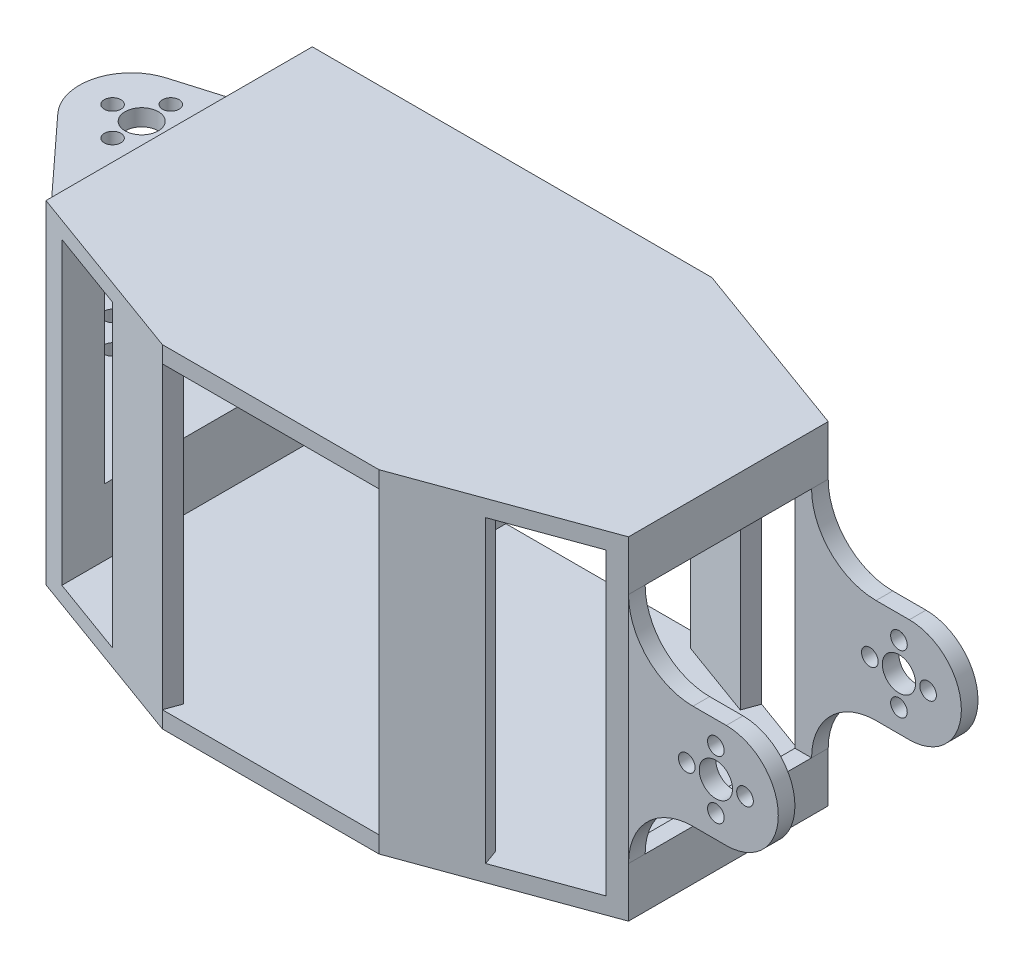
from build123d import *

# Parameters (mm, degrees)
SALIENTE_EXTRUIR1_DEPTH         = 25
CORTAR_EXTRUIR1_REACH           = 63.754
CROQUIS3_R                      = 4
CROQUIS3_R_2                    = 2
CROQUIS4_W                      = 32
CROQUIS4_H                      = 24.152956225
CORTAR_EXTRUIR2_DEPTH           = 40
SALIENTE_EXTRUIR3_DEPTH         = 72.5
SALIENTE_EXTRUIR3_DEPTH_BACK    = 7.5
CORTAR_EXTRUIR4_DEPTH           = 10
CORTAR_EXTRUIR4_DEPTH_BACK      = 10
CROQUIS8_W                      = 40
CROQUIS8_H                      = 62
REDONDEO1_RADIUS                = 12.5
REDONDEO1_LENGTH                = 4
REDONDEO2_RADIUS                = 12.5
REDONDEO2_LENGTH                = 4
CROQUIS9_W                      = 25
CROQUIS9_H                      = 4
SALIENTE_EXTRUIR4_DEPTH         = 36
CROQUIS10_R                     = 4
CROQUIS10_R_2                   = 2
CORTAR_EXTRUIR5_DEPTH           = 36
REDONDEO3_RADIUS                = 12.5
REDONDEO3_LENGTH                = 4
REDONDEO3_OF_SIMETR_A1_2_RADIUS = 12.5
REDONDEO3_OF_SIMETR_A1_2_LENGTH = 4
CROQUIS11_W                     = 56
CROQUIS11_H                     = 40
CORTAR_EXTRUIR6_DEPTH           = 36
CROQUIS16_W                     = 40
CROQUIS16_H                     = 16
SALIENTE_EXTRUIR6_DEPTH         = 6
CORTAR_EXTRUIR7_REACH           = 213.835
CROQUIS17_W                     = 20
CROQUIS17_H                     = 72
SALIENTE_EXTRUIR7_DEPTH         = 4
SALIENTE_EXTRUIR8_DEPTH         = 4
CROQUIS23_W                     = 7.762522615
CROQUIS23_H                     = 40
CORTAR_EXTRUIR8_DEPTH           = 10
CROQUIS20_W                     = 20
CROQUIS20_H                     = 72
SALIENTE_EXTRUIR9_DEPTH         = 4
REDONDEO4_R                     = 15.5
CROQUIS24_W                     = 20
CROQUIS24_H                     = 72
SALIENTE_EXTRUIR10_DEPTH        = 4


with BuildPart() as part:
    # Croquis2 → Saliente-Extruir1 (new body)
    with BuildSketch(Plane(origin=(0, 0, 0), x_dir=(0, 1, 0), z_dir=(0, 0, 1))):
        Polygon((-20, 29.741935484), (-24, 29.741935484), (-24, -6.258064516), (24, -6.258064516), (24, 29.741935484), (20, 29.741935484), (20, -4.258064516), (-20, -4.258064516), align=None)
    extrude(amount=SALIENTE_EXTRUIR1_DEPTH)

    # Cortar-Extruir1: up to this face of the body (flat: up to its plane)
    cortar_extruir1_end = Plane(part.part.faces().sort_by_distance((-11.741935484, -24, 12.5))[0])
    # Croquis3 → Cortar-Extruir1 (cut, up to the picked face)
    with BuildSketch(Plane(origin=(0, 24, 0), x_dir=(-1, 0, 0), z_dir=(0, 1, 0)), mode=Mode.PRIVATE) as cortar_extruir1_sk1:
        with Locations((14.741935484, 12.5)):
            Circle(CROQUIS3_R)
    cortar_extruir1_tool1 = split(extrude(cortar_extruir1_sk1.sketch, amount=-CORTAR_EXTRUIR1_REACH, mode=Mode.PRIVATE), bisect_by=cortar_extruir1_end, keep=Keep.BOTH, mode=Mode.PRIVATE)
    # Croquis3 → Cortar-Extruir1 (cut, up to the picked face)
    with BuildSketch(Plane(origin=(0, 24, 0), x_dir=(-1, 0, 0), z_dir=(0, 1, 0)), mode=Mode.PRIVATE) as cortar_extruir1_sk2:
        with Locations((14.741935484, 19.5)):
            Circle(CROQUIS3_R_2)
    cortar_extruir1_tool2 = split(extrude(cortar_extruir1_sk2.sketch, amount=-CORTAR_EXTRUIR1_REACH, mode=Mode.PRIVATE), bisect_by=cortar_extruir1_end, keep=Keep.BOTH, mode=Mode.PRIVATE)
    # Croquis3 → Cortar-Extruir1 (cut, up to the picked face)
    with BuildSketch(Plane(origin=(0, 24, 0), x_dir=(-1, 0, 0), z_dir=(0, 1, 0)), mode=Mode.PRIVATE) as cortar_extruir1_sk3:
        with Locations((21.741935484, 12.5)):
            Circle(CROQUIS3_R_2)
    cortar_extruir1_tool3 = split(extrude(cortar_extruir1_sk3.sketch, amount=-CORTAR_EXTRUIR1_REACH, mode=Mode.PRIVATE), bisect_by=cortar_extruir1_end, keep=Keep.BOTH, mode=Mode.PRIVATE)
    # Croquis3 → Cortar-Extruir1 (cut, up to the picked face)
    with BuildSketch(Plane(origin=(0, 24, 0), x_dir=(-1, 0, 0), z_dir=(0, 1, 0)), mode=Mode.PRIVATE) as cortar_extruir1_sk4:
        with Locations((14.741935484, 5.5)):
            Circle(CROQUIS3_R_2)
    cortar_extruir1_tool4 = split(extrude(cortar_extruir1_sk4.sketch, amount=-CORTAR_EXTRUIR1_REACH, mode=Mode.PRIVATE), bisect_by=cortar_extruir1_end, keep=Keep.BOTH, mode=Mode.PRIVATE)
    # Croquis3 → Cortar-Extruir1 (cut, up to the picked face)
    with BuildSketch(Plane(origin=(0, 24, 0), x_dir=(-1, 0, 0), z_dir=(0, 1, 0)), mode=Mode.PRIVATE) as cortar_extruir1_sk5:
        with Locations((7.741935484, 12.5)):
            Circle(CROQUIS3_R_2)
    cortar_extruir1_tool5 = split(extrude(cortar_extruir1_sk5.sketch, amount=-CORTAR_EXTRUIR1_REACH, mode=Mode.PRIVATE), bisect_by=cortar_extruir1_end, keep=Keep.BOTH, mode=Mode.PRIVATE)
    add(cortar_extruir1_tool1.solids().sort_by(Axis((-14.741935, 24, 12.5), (0, -1, 0)))[0], mode=Mode.SUBTRACT)
    add(cortar_extruir1_tool2.solids().sort_by(Axis((-14.741935, 24, 19.5), (0, -1, 0)))[0], mode=Mode.SUBTRACT)
    add(cortar_extruir1_tool3.solids().sort_by(Axis((-21.741935, 24, 12.5), (0, -1, 0)))[0], mode=Mode.SUBTRACT)
    add(cortar_extruir1_tool4.solids().sort_by(Axis((-14.741935, 24, 5.5), (0, -1, 0)))[0], mode=Mode.SUBTRACT)
    add(cortar_extruir1_tool5.solids().sort_by(Axis((-7.741935, 24, 12.5), (0, -1, 0)))[0], mode=Mode.SUBTRACT)

    # Croquis4 → Cortar-Extruir2 (cut)
    with BuildSketch(Plane.YZ.offset(6.258064516)):
        with Locations((0, 14.576478113)):
            Rectangle(CROQUIS4_W, CROQUIS4_H)
    extrude(amount=-CORTAR_EXTRUIR2_DEPTH, mode=Mode.SUBTRACT)

    # Croquis5 → Saliente-Extruir3 (add, two sides: drawn at the far end of the back side and taken through both)
    # profile 1 of 2: a face of its own
    with BuildSketch(Plane(origin=(0, 0, 0), x_dir=(0, 1, 0), z_dir=(0, 0, 1)).offset(-SALIENTE_EXTRUIR3_DEPTH_BACK)):
        Polygon((-24, -6.258064516), (-40, -6.258064516), (-40, -10.258064516), (-40, -146.258064516), (-36, -146.258064516), (36, -146.258064516), (40, -146.258064516), (40, -10.258064516), (40, -6.258064516), (24, -6.258064516), (0, -6.258064516), align=None)
        Polygon((-36, -12.258064516), (0, -12.258064516), (36, -12.258064516), (36, -142.258064516), (-36, -142.258064516), align=None, mode=Mode.SUBTRACT)
    # profile 2 of 2: a face of its own
    with BuildSketch(Plane(origin=(0, 0, 0), x_dir=(0, 1, 0), z_dir=(0, 0, 1)).offset(-SALIENTE_EXTRUIR3_DEPTH_BACK)):
        Polygon((-24, -6.258064516), (-40, -6.258064516), (-40, -10.258064516), (-40, -146.258064516), (-36, -146.258064516), (36, -146.258064516), (40, -146.258064516), (40, -10.258064516), (40, -6.258064516), (24, -6.258064516), (0, -6.258064516), align=None)
        Polygon((-36, -12.258064516), (0, -12.258064516), (36, -12.258064516), (36, -142.258064516), (-36, -142.258064516), align=None, mode=Mode.SUBTRACT)
    extrude(amount=SALIENTE_EXTRUIR3_DEPTH + SALIENTE_EXTRUIR3_DEPTH_BACK)

    # Croquis8 → Cortar-Extruir4 (cut, two sides: drawn at the far end of the back side and taken through both)
    with BuildSketch(Plane(origin=(6.258064516, 0, 0), x_dir=(0, -1, 0), z_dir=(-1, 0, 0)).offset(-CORTAR_EXTRUIR4_DEPTH_BACK)):
        with Locations((0, 33.5)):
            Rectangle(CROQUIS8_W, CROQUIS8_H)
    extrude(amount=CORTAR_EXTRUIR4_DEPTH + CORTAR_EXTRUIR4_DEPTH_BACK, mode=Mode.SUBTRACT)

    # Redondeo1: full round fillet: the end face becomes a half cylinder, R = half its width
    redondeo1_face = Plane((-29.741935484, 22, 12.5), x_dir=(0, -1, 0), z_dir=(-1, 0, 0))  # on the end face: x along it, z out of the body
    redondeo1_slab = redondeo1_face.offset(-REDONDEO1_RADIUS / 2) * Box(REDONDEO1_LENGTH, 2 * REDONDEO1_RADIUS, REDONDEO1_RADIUS, mode=Mode.PRIVATE)  # the body's end, R deep
    redondeo1_round = Plane((-17.241935484, 22, 12.5), x_dir=(-1, 0, 0), z_dir=(0, -1, 0)) * Cylinder(REDONDEO1_RADIUS, REDONDEO1_LENGTH, mode=Mode.PRIVATE)  # its axis R under the face
    add(redondeo1_slab - redondeo1_round, mode=Mode.SUBTRACT)

    # Redondeo2: full round fillet: the end face becomes a half cylinder, R = half its width
    redondeo2_face = Plane((-29.741935484, -22, 12.5), x_dir=(0, -1, 0), z_dir=(-1, 0, 0))  # on the end face: x along it, z out of the body
    redondeo2_slab = redondeo2_face.offset(-REDONDEO2_RADIUS / 2) * Box(REDONDEO2_LENGTH, 2 * REDONDEO2_RADIUS, REDONDEO2_RADIUS, mode=Mode.PRIVATE)  # the body's end, R deep
    redondeo2_round = Plane((-17.241935484, -22, 12.5), x_dir=(-1, 0, 0), z_dir=(0, -1, 0)) * Cylinder(REDONDEO2_RADIUS, REDONDEO2_LENGTH, mode=Mode.PRIVATE)  # its axis R under the face
    add(redondeo2_slab - redondeo2_round, mode=Mode.SUBTRACT)

    # Croquis9 → Saliente-Extruir4 (add)
    with BuildSketch(Plane.YZ.offset(146.258064516)):
        with Locations((0, 54.5)):
            Rectangle(CROQUIS9_W, CROQUIS9_H)
    saliente_extruir4 = extrude(amount=SALIENTE_EXTRUIR4_DEPTH)

    # Croquis10 → Cortar-Extruir5 (cut)
    with BuildSketch(Plane.XY.offset(56.5)):
        with Locations((167.258064516, 0)):
            Circle(CROQUIS10_R)
        with Locations((167.258064516, 7)):
            Circle(CROQUIS10_R_2)
        with Locations((174.258064516, 0)):
            Circle(CROQUIS10_R_2)
        with Locations((167.258064516, -7)):
            Circle(CROQUIS10_R_2)
        with Locations((160.258064516, 0)):
            Circle(CROQUIS10_R_2)
    cortar_extruir5 = extrude(amount=-CORTAR_EXTRUIR5_DEPTH, mode=Mode.SUBTRACT)

    # Redondeo3: full round fillet: the end face becomes a half cylinder, R = half its width
    redondeo3_face = Plane((182.258064516, 0, 54.5), x_dir=(0, 0, -1), z_dir=(1, 0, 0))  # on the end face: x along it, z out of the body
    redondeo3_slab = redondeo3_face.offset(-REDONDEO3_RADIUS / 2) * Box(REDONDEO3_LENGTH, 2 * REDONDEO3_RADIUS, REDONDEO3_RADIUS, mode=Mode.PRIVATE)  # the body's end, R deep
    redondeo3_round = Plane((169.758064516, 0, 54.5), x_dir=(1, 0, 0), z_dir=(0, 0, -1)) * Cylinder(REDONDEO3_RADIUS, REDONDEO3_LENGTH, mode=Mode.PRIVATE)  # its axis R under the face
    add(redondeo3_slab - redondeo3_round, mode=Mode.SUBTRACT)

    # Simetría1: Saliente-Extruir4, Cortar-Extruir5 across plane
    add(saliente_extruir4.mirror(Plane(origin=(0, 0, 32.5), x_dir=(1, 0, 0), z_dir=(0, 0, -1))))
    add(cortar_extruir5.mirror(Plane(origin=(0, 0, 32.5), x_dir=(1, 0, 0), z_dir=(0, 0, -1))), mode=Mode.SUBTRACT)

    # Redondeo3 of Simetr_a1 2: full round fillet: the end face becomes a half cylinder, R = half its width
    redondeo3_of_simetr_a1_2_face = Plane((182.258064516, 0, 10.5), x_dir=(0, 0, 1), z_dir=(1, 0, 0))  # on the end face: x along it, z out of the body
    redondeo3_of_simetr_a1_2_slab = redondeo3_of_simetr_a1_2_face.offset(-REDONDEO3_OF_SIMETR_A1_2_RADIUS / 2) * Box(REDONDEO3_OF_SIMETR_A1_2_LENGTH, 2 * REDONDEO3_OF_SIMETR_A1_2_RADIUS, REDONDEO3_OF_SIMETR_A1_2_RADIUS, mode=Mode.PRIVATE)  # the body's end, R deep
    redondeo3_of_simetr_a1_2_round = Plane((169.758064516, 0, 10.5), x_dir=(1, 0, 0), z_dir=(0, 0, 1)) * Cylinder(REDONDEO3_OF_SIMETR_A1_2_RADIUS, REDONDEO3_OF_SIMETR_A1_2_LENGTH, mode=Mode.PRIVATE)  # its axis R under the face
    add(redondeo3_of_simetr_a1_2_slab - redondeo3_of_simetr_a1_2_round, mode=Mode.SUBTRACT)

    # Croquis11 → Cortar-Extruir6 (cut)
    with BuildSketch(Plane.YZ.offset(146.258064516)):
        with Locations((0, 32.5)):
            Rectangle(CROQUIS11_W, CROQUIS11_H)
    extrude(amount=-CORTAR_EXTRUIR6_DEPTH, mode=Mode.SUBTRACT)

    # Croquis16 → Saliente-Extruir6 (add)
    with BuildSketch(Plane(origin=(6.258064516, 0, 0), x_dir=(0, -1, 0), z_dir=(-1, 0, 0))):
        with Locations((0, 56.5)):
            Rectangle(CROQUIS16_W, CROQUIS16_H)
    extrude(amount=-SALIENTE_EXTRUIR6_DEPTH)

    # Cortar-Extruir7: up to this face of the body (flat: up to its plane)
    cortar_extruir7_end = Plane(part.part.faces().sort_by_distance((76.258064516, 40, 32.5))[0])
    # Croquis13 → Cortar-Extruir7 (cut, up to the picked face)
    with BuildSketch(Plane.XZ.offset(40), mode=Mode.PRIVATE) as cortar_extruir7_sk1:
        Polygon((146.258064516, 56.5), (102.298425805, 72.5), (129.909854681, 81.687925148), (158.719324771, 75.301589413), align=None)
    cortar_extruir7_tool1 = split(extrude(cortar_extruir7_sk1.sketch, amount=-CORTAR_EXTRUIR7_REACH, mode=Mode.PRIVATE), bisect_by=cortar_extruir7_end, keep=Keep.BOTH, mode=Mode.PRIVATE)
    # Croquis13 → Cortar-Extruir7 (cut, up to the picked face)
    with BuildSketch(Plane.XZ.offset(40), mode=Mode.PRIVATE) as cortar_extruir7_sk2:
        Polygon((129.909854681, -16.687925148), (158.719324771, -10.301589413), (146.258064516, 8.5), (102.298425805, -7.5), align=None)
    cortar_extruir7_tool2 = split(extrude(cortar_extruir7_sk2.sketch, amount=-CORTAR_EXTRUIR7_REACH, mode=Mode.PRIVATE), bisect_by=cortar_extruir7_end, keep=Keep.BOTH, mode=Mode.PRIVATE)
    # Croquis13 → Cortar-Extruir7 (cut, up to the picked face)
    with BuildSketch(Plane.XZ.offset(40), mode=Mode.PRIVATE) as cortar_extruir7_sk3:
        Polygon((22.606274351, 81.687925148), (-6.203195739, 75.301589413), (6.258064516, 56.5), (50.217703227, 72.5), align=None)
    cortar_extruir7_tool3 = split(extrude(cortar_extruir7_sk3.sketch, amount=-CORTAR_EXTRUIR7_REACH, mode=Mode.PRIVATE), bisect_by=cortar_extruir7_end, keep=Keep.BOTH, mode=Mode.PRIVATE)
    add(cortar_extruir7_tool1.solids().sort_by(Axis((134.120228, -40, 70.624801), (0, 1, 0)))[0], mode=Mode.SUBTRACT)
    add(cortar_extruir7_tool2.solids().sort_by(Axis((134.120228, -40, -5.624801), (0, 1, 0)))[0], mode=Mode.SUBTRACT)
    add(cortar_extruir7_tool3.solids().sort_by(Axis((18.395901, -40, 70.624801), (0, 1, 0)))[0], mode=Mode.SUBTRACT)

    # Croquis17 → Saliente-Extruir7 (add)
    with BuildSketch(Plane(origin=(35.26769344, 0, 96.897191362), x_dir=(0.9396926207859081, 0, -0.3420201433256698), z_dir=(0.3420201433256698, 0, 0.9396926207859081))):
        with Locations((81.332615456, 0)):
            Rectangle(CROQUIS17_W, CROQUIS17_H)
    saliente_extruir7 = extrude(amount=-SALIENTE_EXTRUIR7_DEPTH)

    # Simetría2: Saliente-Extruir7 across plane
    add(saliente_extruir7.mirror(Plane(origin=(0, 0, 32.5), x_dir=(1, 0, 0), z_dir=(0, 0, -1))))

    # Croquis18 → Saliente-Extruir8 (add)
    with BuildSketch(Plane.XZ.offset(24)):
        with BuildLine():
            Line((6.258064516, 0), (6.258064516, -2.578475779))
            Line((6.258064516, -2.578475779), (6.258064516, -7.5))
            Line((6.258064516, -7.5), (-20.792991393, 0.515009306))
            ThreePointArc((-20.792991393, 0.515009306), (-19.036039206, 0.129422332), (-17.241935484, 0))
            Line((-17.241935484, 0), (6.258064516, 0))
        make_face()
        Polygon((6.258064516, 56.5), (-26.440391117, 20.963947895), (6.258064516, 25), align=None)
    saliente_extruir8 = extrude(amount=-SALIENTE_EXTRUIR8_DEPTH)

    # Simetría3: Saliente-Extruir8 across plane
    add(saliente_extruir8.mirror(Plane.ZX))

    # Croquis23 → Cortar-Extruir8 (cut)
    with BuildSketch(Plane(origin=(0, 0, 0), x_dir=(1, 0, 0), z_dir=(0, 0, -1))):
        with Locations((2.376803209, 0)):
            Rectangle(CROQUIS23_W, CROQUIS23_H)
    extrude(amount=-CORTAR_EXTRUIR8_DEPTH, mode=Mode.SUBTRACT)

    # Croquis20 → Saliente-Extruir9 (add)
    with BuildSketch(Plane(origin=(-17.426695489, 0, 47.879452352), x_dir=(0.939692620785908, 0, 0.34202014332566977), z_dir=(-0.34202014332566977, 0, 0.9396926207859081))):
        with Locations((61.985665547, 0)):
            Rectangle(CROQUIS20_W, CROQUIS20_H)
    extrude(amount=-SALIENTE_EXTRUIR9_DEPTH)

    # Redondeo4
    redondeo4_edges = [part.edges().sort_by_distance(p)[0] for p in [
        (146.258064516, -12.5, 54.5),
        (146.258064516, 12.5, 54.5),
        (146.258064516, -12.5, 10.5),
        (146.258064516, 12.5, 10.5),
    ]]
    fillet(redondeo4_edges, radius=REDONDEO4_R)

    # Croquis24 → Saliente-Extruir10 (add)
    with BuildSketch(Plane(origin=(0, 0, -7.5), x_dir=(1, 0, 0), z_dir=(0, 0, -1))):
        with Locations((42.791931385, 0)):
            Rectangle(CROQUIS24_W, CROQUIS24_H)
    extrude(amount=-SALIENTE_EXTRUIR10_DEPTH)


solid = part.part
